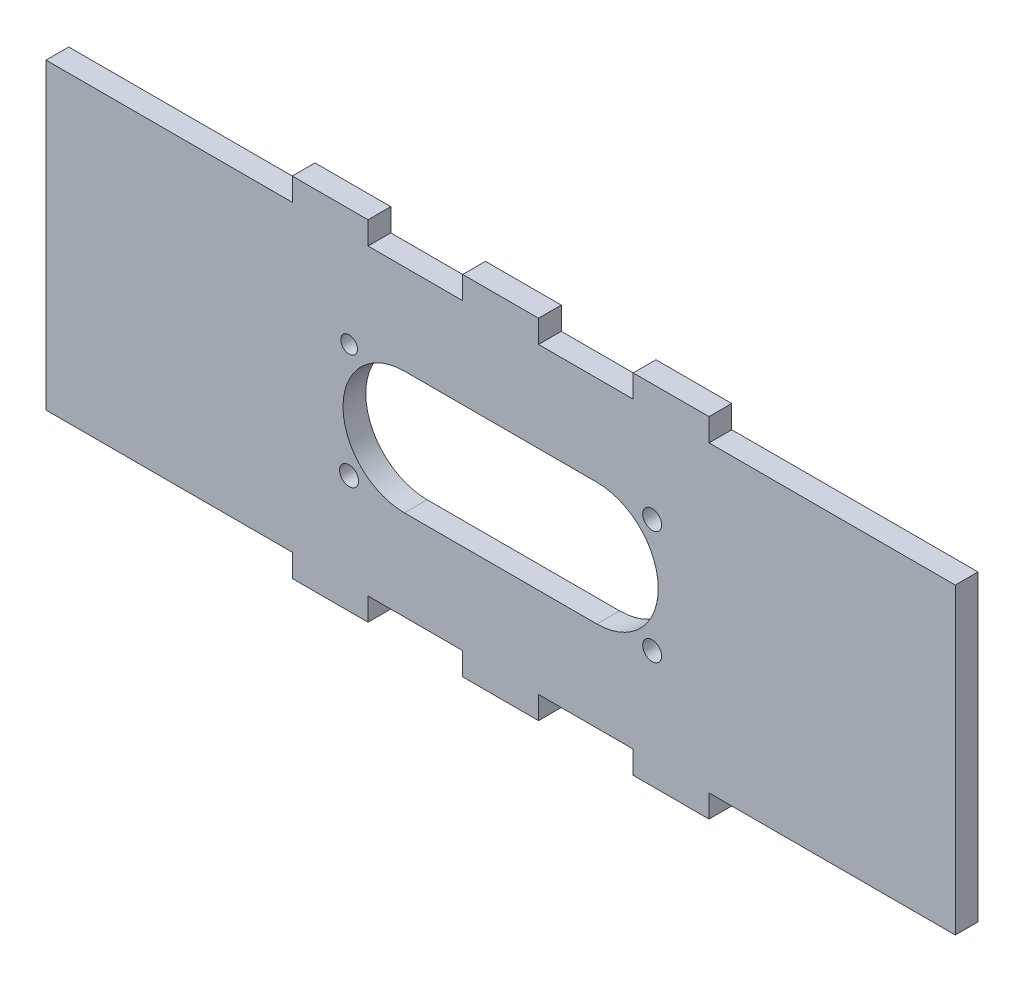
from build123d import *

# Parameters (mm, degrees)
SKETCH1_W           = 10
SKETCH1_H           = 3
BOSS_EXTRUDE1_DEPTH = 3
SKETCH2_R           = 1.1
SKETCH2_R_2         = 1.25
SKETCH2_R_3         = 8.1
CUT_EXTRUDE1_DEPTH  = 65.327288144
SKETCH3_W           = 25.4
SKETCH3_H           = 16.2
CUT_EXTRUDE2_DEPTH  = 65.327288144


with BuildPart() as part:
    # Sketch1 → Boss-Extrude1 (new body)
    with BuildSketch(Plane.XY):
        Polygon((-60, 20), (-60, 0), (60, 0), (60, 20), (27.5, 20), (17.5, 20), (5, 20), (-5, 20), (-17.5, 20), (-27.5, 20), align=None)
        Polygon((60, 0), (-60, 0), (-60, -20), (-27.5, -20), (-17.5, -20), (-5, -20), (5, -20), (17.5, -20), (27.5, -20), (60, -20), align=None)
        with Locations((-22.5, 21.5)):
            Rectangle(SKETCH1_W, SKETCH1_H)
        with Locations((0, 21.5)):
            Rectangle(SKETCH1_W, SKETCH1_H)
        with Locations((22.5, 21.5)):
            Rectangle(SKETCH1_W, SKETCH1_H)
        with Locations((22.5, -21.5)):
            Rectangle(SKETCH1_W, SKETCH1_H)
        with Locations((0, -21.5)):
            Rectangle(SKETCH1_W, SKETCH1_H)
        with Locations((-22.5, -21.5)):
            Rectangle(SKETCH1_W, SKETCH1_H)
    extrude(amount=BOSS_EXTRUDE1_DEPTH)

    # Sketch2 → Cut-Extrude1 (cut, through all)
    with BuildSketch(Plane.XY.offset(3)):
        with Locations((-20, 7.5)):
            Circle(SKETCH2_R)
        with Locations(Location((-20, -7.5, 0), (0, 0, 180))):
            Circle(SKETCH2_R_2)
        with Locations((20, -7.5)):
            Circle(SKETCH2_R_2)
        with Locations(Location((20, 7.5, 0), (0, 0, 180))):
            Circle(SKETCH2_R_2)
        with Locations((-12.7, 0)):
            Circle(SKETCH2_R_3)
        with Locations((12.7, 0)):
            Circle(SKETCH2_R_3)
    extrude(amount=-CUT_EXTRUDE1_DEPTH, mode=Mode.SUBTRACT)

    # Sketch3 → Cut-Extrude2 (cut, through all)
    with BuildSketch(Plane.XY.offset(3)):
        Rectangle(SKETCH3_W, SKETCH3_H)
    extrude(amount=-CUT_EXTRUDE2_DEPTH, mode=Mode.SUBTRACT)


solid = part.part
